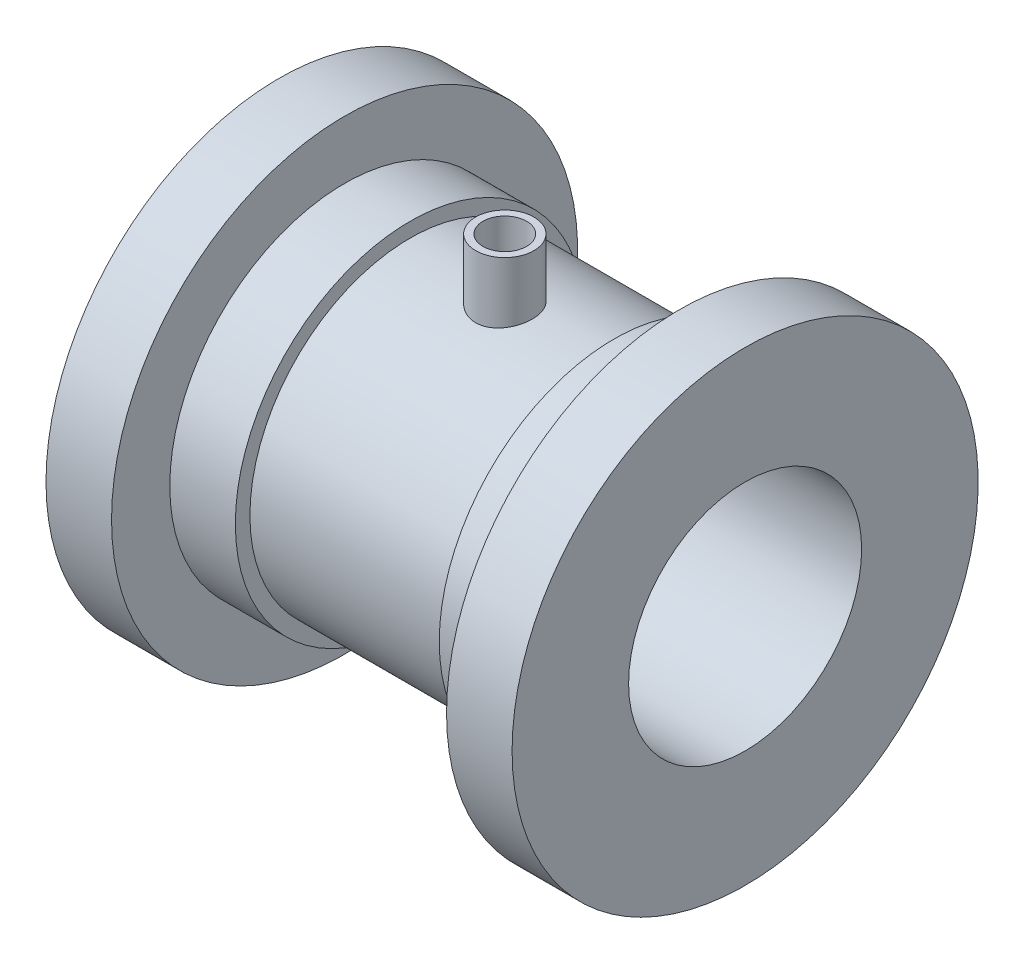
from build123d import *

# Parameters (mm, degrees)
BOSS_EXTRUDE1_REACH      = 96.678
BOSS_EXTRUDE1_END_RADIUS = 22
SKETCH2_R                = 4
SKETCH3_R                = 3
CUT_EXTRUDE1_DEPTH       = 95.678403028


with BuildPart() as part:
    # Sketch1 → Revolve1 (revolve)
    with BuildSketch(Plane.XY, mode=Mode.PRIVATE) as revolve1_sk:
        Polygon((0, 16), (64, 16), (64, 32), (55, 32), (55, 24), (46, 24), (46, 22), (18, 22), (18, 24), (9, 24), (9, 32), (0, 32), align=None)
    revolve(revolve1_sk.sketch.rotate(Axis((0, 0, 0), (1, 0, 0)), 90), axis=Axis((0, 0, 0), (1, 0, 0)))

    # Boss-Extrude1: up to this cylinder (the profile starts outside it)
    boss_extrude1_end = Plane(origin=(32, 0, 0), z_dir=(-1, 0, 0)) * Cylinder(BOSS_EXTRUDE1_END_RADIUS, 238.356, mode=Mode.PRIVATE)
    # Sketch2 → Boss-Extrude1 (add, up to the surface)
    with BuildSketch(Plane(origin=(0, 30, 0), x_dir=(1, 0, 0), z_dir=(0, 1, 0)), mode=Mode.PRIVATE) as boss_extrude1_sk1:
        with Locations(Location((32, -1, 0), (0, 0, 270))):
            Circle(SKETCH2_R)
    boss_extrude1_tool1 = extrude(boss_extrude1_sk1.sketch, amount=-BOSS_EXTRUDE1_REACH, mode=Mode.PRIVATE) - boss_extrude1_end
    add(boss_extrude1_tool1.solids().sort_by_distance((32, 30, 1))[0])

    # Sketch3 → Cut-Extrude1 (cut, through all)
    with BuildSketch(Plane(origin=(0, 30, 0), x_dir=(1, 0, 0), z_dir=(0, 1, 0))):
        with Locations(Location((32, -1, 0), (0, 0, 270))):
            Circle(SKETCH3_R)
    extrude(amount=-CUT_EXTRUDE1_DEPTH, mode=Mode.SUBTRACT)


solid = part.part
